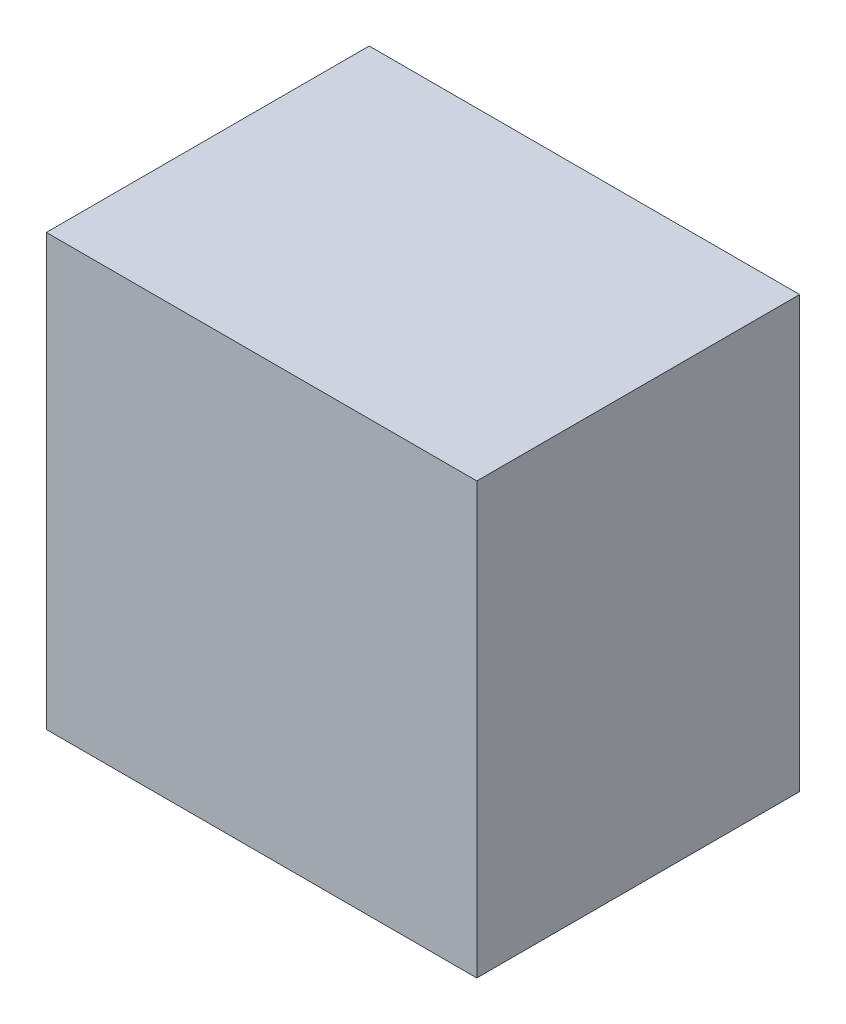
from build123d import *

# Parameters (mm, degrees)
SKETCH1_W           = 2000
SKETCH1_H           = 1500
BOSS_EXTRUDE1_DEPTH = 2000


with BuildPart() as part:
    # Sketch1 → Boss-Extrude1 (new body)
    with BuildSketch(Plane(origin=(0, 0, 0), x_dir=(1, 0, 0), z_dir=(0, 1, 0))):
        Rectangle(SKETCH1_W, SKETCH1_H)
    extrude(amount=BOSS_EXTRUDE1_DEPTH)


solid = part.part
